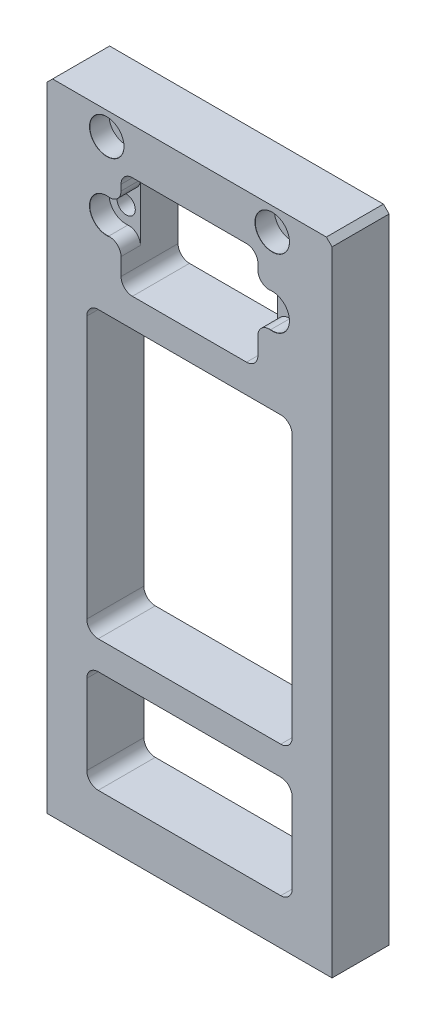
from build123d import *

# Parameters (mm, degrees)
SKETCH1_W                                    = 50
SKETCH1_H                                    = 112
SKETCH1_W_2                                  = 24
SKETCH1_H_2                                  = 18
BOSS_EXTRUDE1_DEPTH                          = 10
SKETCH8_W                                    = 36
SKETCH8_H                                    = 50
SKETCH8_H_2                                  = 18
CUT_EXTRUDE1_DEPTH                           = 116.191145493
CBORE_FOR_M3_HEXAGON_SOCKET_HEAD_CAP_2_COUNT = 2
CBORE_FOR_M3_HEXAGON_SOCKET_HEAD_CAP_2_PITCH = 12
CBORE_FOR_M3_HEXAGON_SOCKET_HEAD_CAP_3_COUNT = 2
CBORE_FOR_M3_HEXAGON_SOCKET_HEAD_CAP_3_PITCH = 29
CBORE_FOR_M3_HEXAGON_SOCKET_HEAD_CAP_4_COUNT = 2
CBORE_FOR_M3_HEXAGON_SOCKET_HEAD_CAP_4_PITCH = 31.384709653
CHAMFER1_SIZE                                = 1
FILLET1_R                                    = 2
M3_TAPPED_HOLE1_D                            = 2.5
M3_TAPPED_HOLE1_DEPTH                        = 9.5
M3_TAPPED_HOLE1_CSINK_D                      = 3.05
M3_TAPPED_HOLE1_CSINK_ANGLE                  = 90
M3_TAPPED_HOLE1_TIP                          = 0.751075774


with BuildPart() as part:
    # Sketch1 → Boss-Extrude1 (new body)
    with BuildSketch(Plane.XY):
        with Locations((0, -56)):
            Rectangle(SKETCH1_W, SKETCH1_H)
        with Locations((0, -17)):
            Rectangle(SKETCH1_W_2, SKETCH1_H_2, mode=Mode.SUBTRACT)
    extrude(amount=BOSS_EXTRUDE1_DEPTH)

    # Sketch8 → Cut-Extrude1 (cut, through all)
    with BuildSketch(Plane.XY.offset(10)):
        with Locations((0, -56)):
            Rectangle(SKETCH8_W, SKETCH8_H)
        with Locations((0, -95)):
            Rectangle(SKETCH8_W, SKETCH8_H_2)
    extrude(amount=-CUT_EXTRUDE1_DEPTH, mode=Mode.SUBTRACT)

    # Sketch7 → CBORE for M3 Hexagon socket head cap screws3 (revolve, cut)
    with BuildSketch(Plane(origin=(-14.5, -4, 10), x_dir=(0, -1, 0), z_dir=(1, 0, 0))):
        Polygon((0, 0), (0, 10), (1.6, 10), (1.6, 3.4), (3, 3.4), (3, 0.025), (3.025, 0), align=None)
    cbore_for_m3_hexagon_socket_head_cap_scr = revolve(axis=Axis((-14.5, -4, 16.35), (0, 0, -1)), mode=Mode.SUBTRACT)

    # CBORE for M3 Hexagon socket head cap 2: CBORE for M3 Hexagon socket head cap screws3 ×2
    with Locations(*[(0, -i * CBORE_FOR_M3_HEXAGON_SOCKET_HEAD_CAP_2_PITCH, 0) for i in range(1, CBORE_FOR_M3_HEXAGON_SOCKET_HEAD_CAP_2_COUNT)]):
        add(cbore_for_m3_hexagon_socket_head_cap_scr, mode=Mode.SUBTRACT)

    # CBORE for M3 Hexagon socket head cap 3: CBORE for M3 Hexagon socket head cap screws3 ×2
    with Locations(*[(i * CBORE_FOR_M3_HEXAGON_SOCKET_HEAD_CAP_3_PITCH, 0, 0) for i in range(1, CBORE_FOR_M3_HEXAGON_SOCKET_HEAD_CAP_3_COUNT)]):
        add(cbore_for_m3_hexagon_socket_head_cap_scr, mode=Mode.SUBTRACT)

    # CBORE for M3 Hexagon socket head cap 4: CBORE for M3 Hexagon socket head cap screws3 ×2
    with Locations(*[Vector(0.9240168324218909, -0.38235179272629954, 0) * (i * CBORE_FOR_M3_HEXAGON_SOCKET_HEAD_CAP_4_PITCH) for i in range(1, CBORE_FOR_M3_HEXAGON_SOCKET_HEAD_CAP_4_COUNT)]):
        add(cbore_for_m3_hexagon_socket_head_cap_scr, mode=Mode.SUBTRACT)

    # Chamfer1
    chamfer1_edges = [part.edges().sort_by_distance(p)[0] for p in [
        (-25, 0, 5),
        (25, 0, 5),
    ]]
    chamfer(chamfer1_edges, length=CHAMFER1_SIZE)

    # Fillet1
    fillet1_edges = [part.edges().sort_by_distance(p)[0] for p in [
        (-12, -8, 5),
        (-12, -26, 5),
        (12, -26, 5),
        (12, -8, 5),
        (-12, -14.341687605, 8.2875),
        (-12, -17.658312395, 8.2875),
        (12, -17.658312395, 8.2875),
        (12, -14.341687605, 8.2875),
        (18, -86, 5),
        (18, -104, 5),
        (-18, -104, 5),
        (-18, -86, 5),
        (18, -31, 5),
        (18, -81, 5),
        (-18, -81, 5),
        (-18, -31, 5),
    ]]
    fillet(fillet1_edges, radius=FILLET1_R)

    # M3 Tapped Hole1
    with Locations(Plane(origin=(-21.75, -112, 5), x_dir=(0, 0, -1), z_dir=(0, -1, 0))):
        with Locations((0, 0), (0, 43.5)):
            CounterSinkHole(M3_TAPPED_HOLE1_D / 2, M3_TAPPED_HOLE1_CSINK_D / 2, depth=M3_TAPPED_HOLE1_DEPTH, counter_sink_angle=M3_TAPPED_HOLE1_CSINK_ANGLE)
            with Locations((0, 0, -(M3_TAPPED_HOLE1_DEPTH + M3_TAPPED_HOLE1_TIP / 2))):  # 118° drill point
                Cone(0, M3_TAPPED_HOLE1_D / 2, M3_TAPPED_HOLE1_TIP, mode=Mode.SUBTRACT)


solid = part.part
